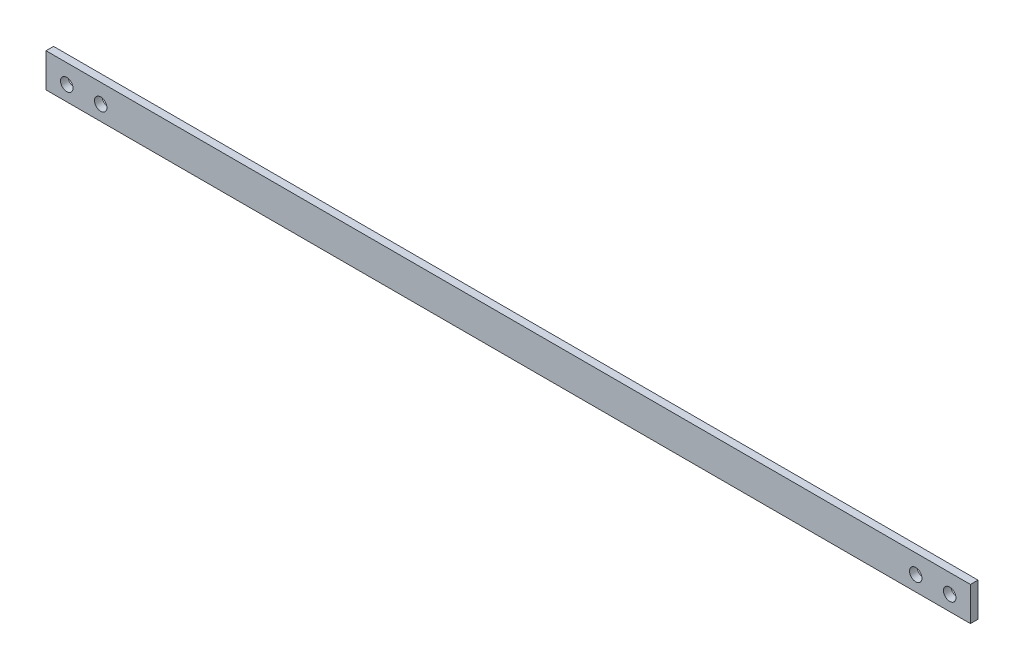
from build123d import *

# Parameters (mm, degrees)
SKETCH_1_W      = 245
SKETCH_1_H      = 9
SKETCH_1_R      = 1.65
EXTRUDE_1_DEPTH = 2


with BuildPart() as part:
    # 草图1 → 凸台-拉伸1 (new body)
    with BuildSketch(Plane.XY):
        with Locations((122.5, 4.5)):
            Rectangle(SKETCH_1_W, SKETCH_1_H)
        with Locations((5.5, 4)):
            Circle(SKETCH_1_R, mode=Mode.SUBTRACT)
        with Locations((14.5, 4)):
            Circle(SKETCH_1_R, mode=Mode.SUBTRACT)
        with Locations(Location((230.5, 4, 0), (0, 0, 180))):
            Circle(SKETCH_1_R, mode=Mode.SUBTRACT)
        with Locations(Location((239.5, 4, 0), (0, 0, 180))):
            Circle(SKETCH_1_R, mode=Mode.SUBTRACT)
    extrude(amount=EXTRUDE_1_DEPTH)


solid = part.part
